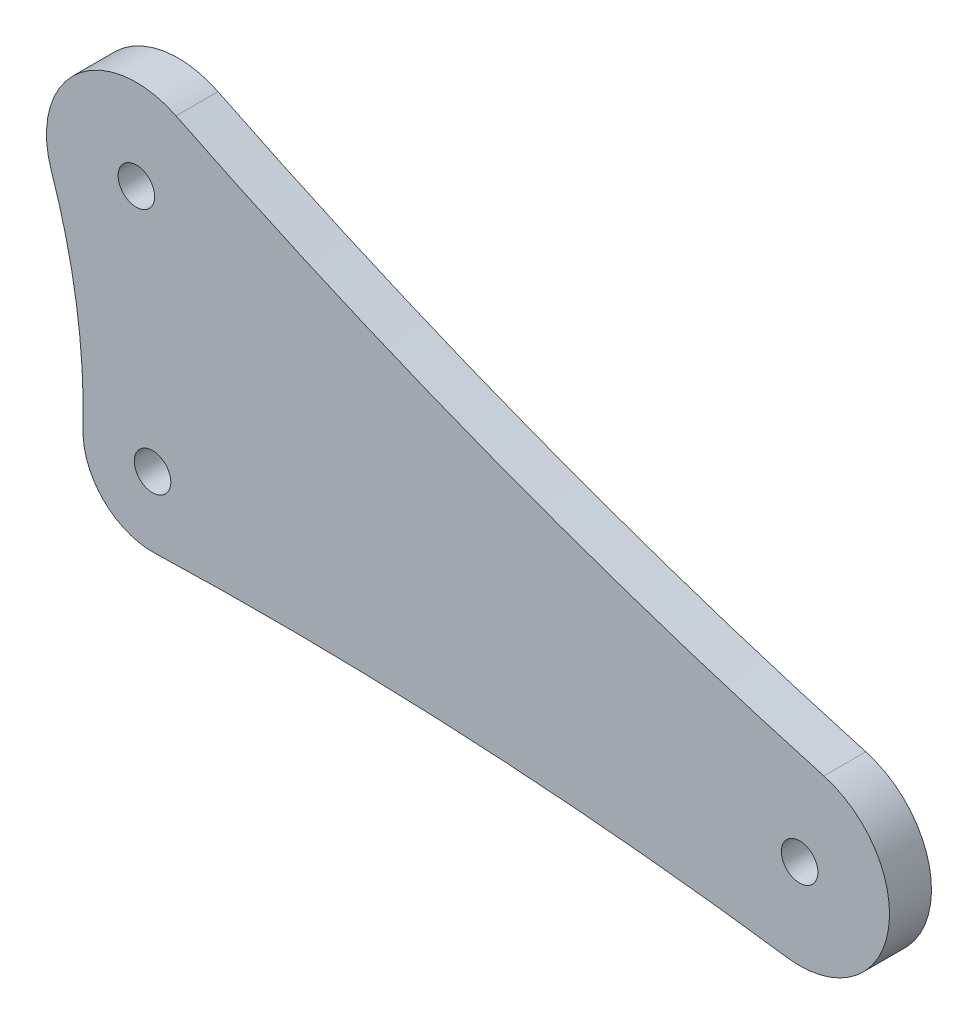
from build123d import *

# Parameters (mm, degrees)
SKETCH1_R           = 1.525
BOSS_EXTRUDE1_DEPTH = 3.5


with BuildPart() as part:
    # Sketch1 → Boss-Extrude1 (new body)
    with BuildSketch(Plane.XY):
        with BuildLine():
            ThreePointArc((-5.798114447, 0.147881218), (-4.091440025, -4.110975374), (0.175497637, -5.79734427))
            ThreePointArc((0.175497637, -5.79734427), (26.625773358, -6.107804645), (52.956740344, -8.636371224))
            ThreePointArc((52.956740344, -8.636371224), (61.328682163, -2.737878642), (56.01066855, 6.014284277))
            ThreePointArc((56.01066855, 6.014284277), (28.510221344, 15.105334328), (1.961063899, 26.683936423))
            ThreePointArc((1.961063899, 26.683936423), (-6.300180669, 25.588718748), (-8.449807785, 17.537211633))
            ThreePointArc((-8.449807785, 17.537211633), (-6.353241495, 8.96007321), (-5.798114447, 0.147881218))
        make_face()
        with Locations((-1.35, 19.954385483)):
            Circle(SKETCH1_R, mode=Mode.SUBTRACT)
        Circle(SKETCH1_R, mode=Mode.SUBTRACT)
        with Locations((53.9865, -1.207401238)):
            Circle(SKETCH1_R, mode=Mode.SUBTRACT)
    extrude(amount=BOSS_EXTRUDE1_DEPTH)


solid = part.part
